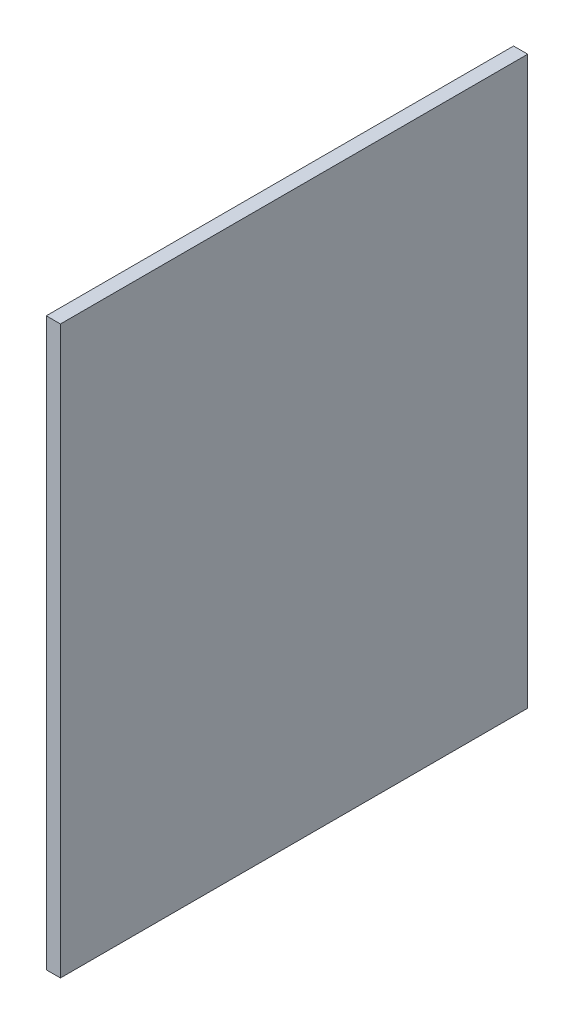
from build123d import *

# Parameters (mm, degrees)
SKETCH_1_W      = 165
SKETCH_1_H      = 200
EXTRUDE_1_DEPTH = 5


with BuildPart() as part:
    # 스케치1 → 보스-돌출1 (new body)
    with BuildSketch(Plane(origin=(0, 0, 0), x_dir=(0, 0, -1), z_dir=(1, 0, 0))):
        with Locations((82.5, 100)):
            Rectangle(SKETCH_1_W, SKETCH_1_H)
    extrude(amount=EXTRUDE_1_DEPTH)


solid = part.part
